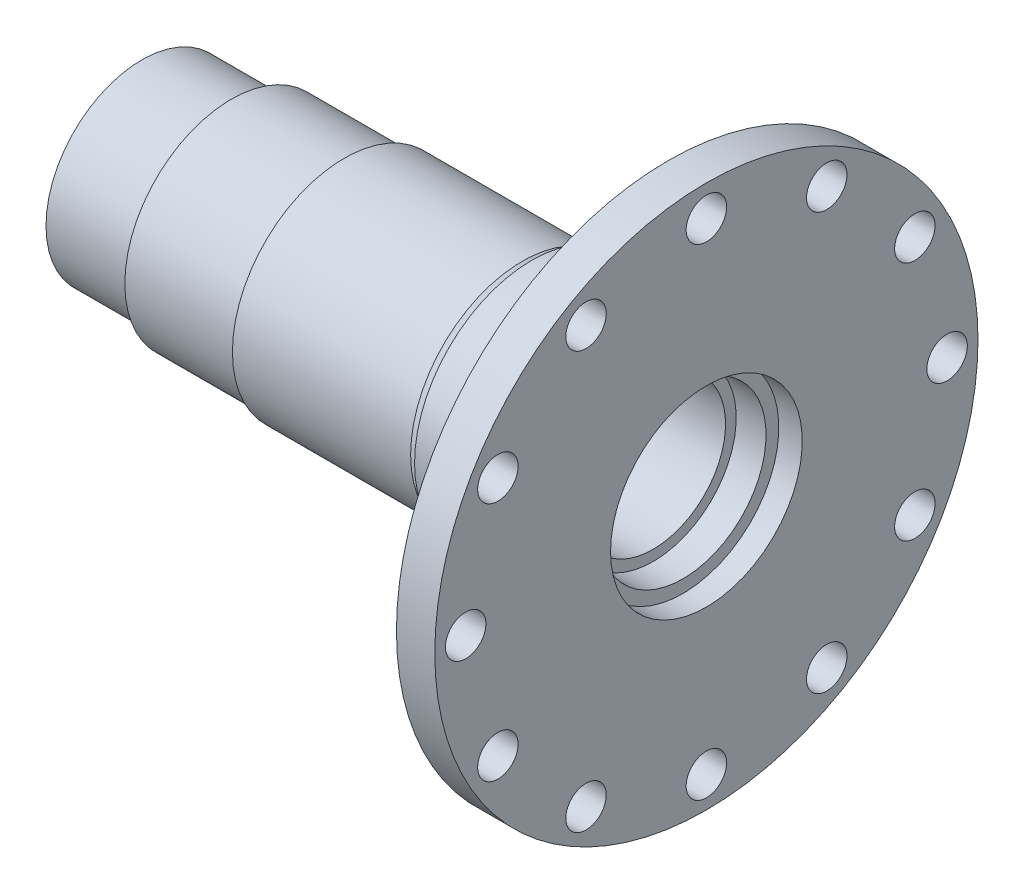
from build123d import *

# Parameters (mm, degrees)
SKETCH_3_R           = 9.5
CUT_EXTRUDE_1_DEPTH  = 321.526909947
SKETCH_4_R           = 9.5
CUT_EXTRUDE_2_DEPTH  = 321.526909947
SKETCH_5_R           = 9.5
CUT_EXTRUDE_3_DEPTH  = 321.526909947
SKETCH_6_R           = 9.5
CUT_EXTRUDE_4_DEPTH  = 321.526909947
SKETCH_7_R           = 9.5
CUT_EXTRUDE_5_DEPTH  = 321.526909947
SKETCH_8_R           = 9.5
CUT_EXTRUDE_6_DEPTH  = 321.526909947
SKETCH_9_R           = 9.5
CUT_EXTRUDE_7_DEPTH  = 321.526909947
SKETCH_10_R          = 9.5
CUT_EXTRUDE_8_DEPTH  = 321.526909947
SKETCH_11_R          = 9.5
CUT_EXTRUDE_9_DEPTH  = 321.526909947
SKETCH_12_R          = 9.5
CUT_EXTRUDE_10_DEPTH = 321.526909947
SKETCH_13_R          = 9.5
CUT_EXTRUDE_11_DEPTH = 321.526909947
SKETCH_14_R          = 9.5
CUT_EXTRUDE_12_DEPTH = 321.526909947


with BuildPart() as part:
    # Эскиз1 → Повернуть1 (revolve)
    with BuildSketch(Plane.XY, mode=Mode.PRIVATE) as revolve_1_sk:
        Polygon((0, 0), (265, 0), (265, 127.5), (247, 127.5), (247, 100), (239, 100), (239, 62.5), (215, 62.5), (215, 55), (183, 55), (178.669872981, 52.5), (95, 52.5), (95, 50), (42, 50), (42, 45), (0, 45), align=None)
    revolve(revolve_1_sk.sketch.rotate(Axis((0, 0, 0), (1, 0, 0)), 90), axis=Axis((0, 0, 0), (1, 0, 0)))

    # Эскиз2 → Вырез-Повернуть1 (revolve, cut)
    with BuildSketch(Plane.XY, mode=Mode.PRIVATE) as cut_revolve_1_sk:
        Polygon((0, 0), (265, 0), (265, 45), (254, 45), (254, 39), (240, 39), (240, 34), (203.5, 34), (203.5, 31), (0, 31), align=None)
    revolve(cut_revolve_1_sk.sketch.rotate(Axis((0, 0, 0), (1, 0, 0)), 90), axis=Axis((0, 0, 0), (1, 0, 0)), mode=Mode.SUBTRACT)

    # Эскиз3 → Вырез-Вытянуть1 (cut, through all)
    with BuildSketch(Plane(origin=(0, 0, 0), x_dir=(0, 0, -1), z_dir=(1, 0, 0))):
        with Locations((0, 113)):
            Circle(SKETCH_3_R)
    extrude(amount=CUT_EXTRUDE_1_DEPTH, mode=Mode.SUBTRACT)

    # Эскиз4 → Вырез-Вытянуть2 (cut, through all)
    with BuildSketch(Plane(origin=(0, 0, 0), x_dir=(0, 0, -1), z_dir=(1, 0, 0))):
        with Locations((-56.5, 97.860870628)):
            Circle(SKETCH_4_R)
    extrude(amount=CUT_EXTRUDE_2_DEPTH, mode=Mode.SUBTRACT)

    # Эскиз5 → Вырез-Вытянуть3 (cut, through all)
    with BuildSketch(Plane(origin=(0, 0, 0), x_dir=(0, 0, -1), z_dir=(1, 0, 0))):
        with Locations((-97.860870628, 56.5)):
            Circle(SKETCH_5_R)
    extrude(amount=CUT_EXTRUDE_3_DEPTH, mode=Mode.SUBTRACT)

    # Эскиз6 → Вырез-Вытянуть4 (cut, through all)
    with BuildSketch(Plane(origin=(0, 0, 0), x_dir=(0, 0, -1), z_dir=(1, 0, 0))):
        with Locations((-113, 0)):
            Circle(SKETCH_6_R)
    extrude(amount=CUT_EXTRUDE_4_DEPTH, mode=Mode.SUBTRACT)

    # Эскиз7 → Вырез-Вытянуть5 (cut, through all)
    with BuildSketch(Plane(origin=(0, 0, 0), x_dir=(0, 0, -1), z_dir=(1, 0, 0))):
        with Locations((-97.860870628, -56.5)):
            Circle(SKETCH_7_R)
    extrude(amount=CUT_EXTRUDE_5_DEPTH, mode=Mode.SUBTRACT)

    # Эскиз8 → Вырез-Вытянуть6 (cut, through all)
    with BuildSketch(Plane(origin=(0, 0, 0), x_dir=(0, 0, -1), z_dir=(1, 0, 0))):
        with Locations((-56.5, -97.860870628)):
            Circle(SKETCH_8_R)
    extrude(amount=CUT_EXTRUDE_6_DEPTH, mode=Mode.SUBTRACT)

    # Эскиз9 → Вырез-Вытянуть7 (cut, through all)
    with BuildSketch(Plane(origin=(0, 0, 0), x_dir=(0, 0, -1), z_dir=(1, 0, 0))):
        with Locations((0, -113)):
            Circle(SKETCH_9_R)
    extrude(amount=CUT_EXTRUDE_7_DEPTH, mode=Mode.SUBTRACT)

    # Эскиз10 → Вырез-Вытянуть8 (cut, through all)
    with BuildSketch(Plane(origin=(0, 0, 0), x_dir=(0, 0, -1), z_dir=(1, 0, 0))):
        with Locations((56.5, -97.860870628)):
            Circle(SKETCH_10_R)
    extrude(amount=CUT_EXTRUDE_8_DEPTH, mode=Mode.SUBTRACT)

    # Эскиз11 → Вырез-Вытянуть9 (cut, through all)
    with BuildSketch(Plane(origin=(0, 0, 0), x_dir=(0, 0, -1), z_dir=(1, 0, 0))):
        with Locations((97.860870628, -56.5)):
            Circle(SKETCH_11_R)
    extrude(amount=CUT_EXTRUDE_9_DEPTH, mode=Mode.SUBTRACT)

    # Эскиз12 → Вырез-Вытянуть10 (cut, through all)
    with BuildSketch(Plane(origin=(0, 0, 0), x_dir=(0, 0, -1), z_dir=(1, 0, 0))):
        with Locations((113, 0)):
            Circle(SKETCH_12_R)
    extrude(amount=CUT_EXTRUDE_10_DEPTH, mode=Mode.SUBTRACT)

    # Эскиз13 → Вырез-Вытянуть11 (cut, through all)
    with BuildSketch(Plane(origin=(0, 0, 0), x_dir=(0, 0, -1), z_dir=(1, 0, 0))):
        with Locations((97.860870628, 56.5)):
            Circle(SKETCH_13_R)
    extrude(amount=CUT_EXTRUDE_11_DEPTH, mode=Mode.SUBTRACT)

    # Эскиз14 → Вырез-Вытянуть12 (cut, through all)
    with BuildSketch(Plane(origin=(0, 0, 0), x_dir=(0, 0, -1), z_dir=(1, 0, 0))):
        with Locations((56.5, 97.860870628)):
            Circle(SKETCH_14_R)
    extrude(amount=CUT_EXTRUDE_12_DEPTH, mode=Mode.SUBTRACT)


solid = part.part
